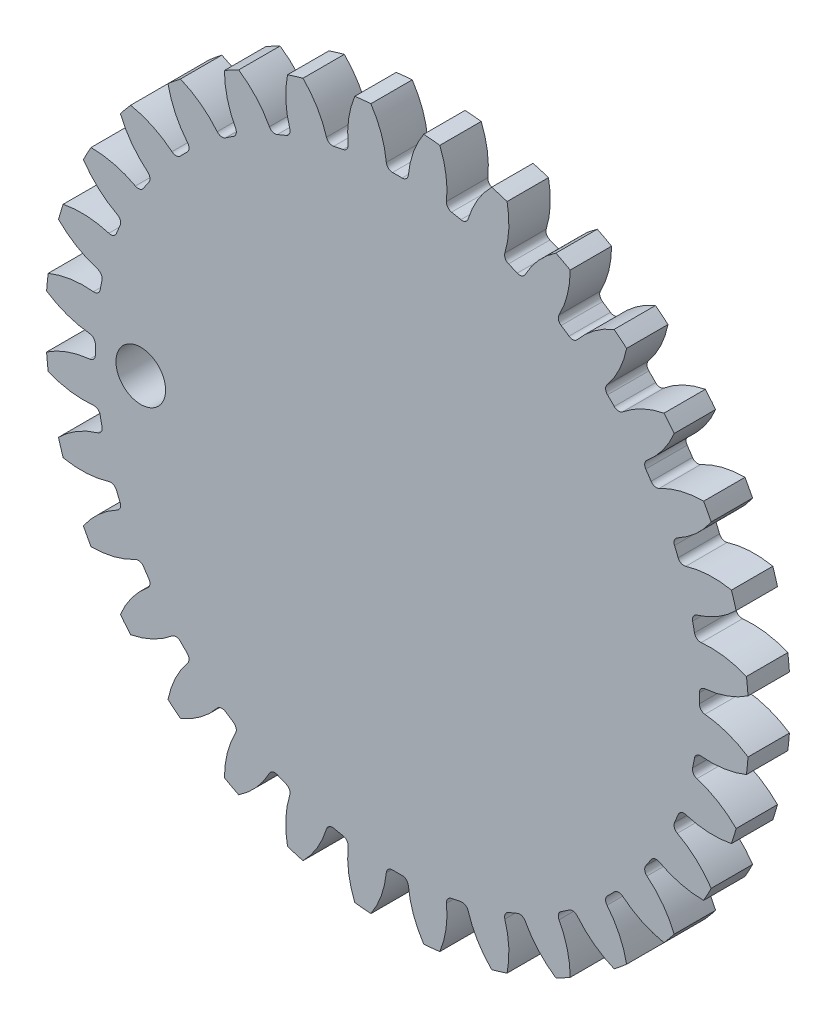
from build123d import *

# Parameters (mm, degrees)
SKETCH1_R                = 53.975
BOSS_EXTRUDE1_DEPTH      = 6.35
CUT_EXTRUDE1_DEPTH       = 6.35
FILLET1_R                = 0.9525
CIRPATTERN1_COUNT        = 32
FILLET1_OF_CIRPATTERN1_R = 0.9525
SKETCH4_R                = 12.065
BOSS_EXTRUDE2_DEPTH      = 6.35
SKETCH7_R                = 3.81
CUT_EXTRUDE2_DEPTH       = 77.380639867


with BuildPart() as part:
    # Sketch1 → Boss-Extrude1 (new body)
    with BuildSketch(Plane.XY):
        Circle(SKETCH1_R)
    extrude(amount=BOSS_EXTRUDE1_DEPTH)

    # Sketch2 → Cut-Extrude1 (cut)
    with BuildSketch(Plane.XY.offset(6.35)):
        with BuildLine():
            ThreePointArc((-1.634103754, 46.326188381), (-2.514224632, 50.797718303), (-4.74898903, 54.76949633))
            ThreePointArc((-4.74898903, 54.76949633), (0, 54.975), (4.74898903, 54.76949633))
            ThreePointArc((4.74898903, 54.76949633), (2.514224632, 50.797718303), (1.634103754, 46.326188381))
            ThreePointArc((1.634103754, 46.326188381), (0, 46.355), (-1.634103754, 46.326188381))
        make_face()
    cut_extrude1 = extrude(amount=-CUT_EXTRUDE1_DEPTH, mode=Mode.SUBTRACT)

    # Fillet1
    fillet1_edges = [part.edges().sort_by_distance(p)[0] for p in [
        (-1.634103754, 46.326188381, 3.175),
        (1.634103754, 46.326188381, 3.175),
    ]]
    fillet(fillet1_edges, radius=FILLET1_R)

    # CirPattern1: Cut-Extrude1 ×32 about axis
    cirpattern1_axis = Axis((0, 0, 0), (0, 0, 1))
    for i in range(1, CIRPATTERN1_COUNT):
        add(cut_extrude1.rotate(cirpattern1_axis, i * 360 / CIRPATTERN1_COUNT), mode=Mode.SUBTRACT)

    # Fillet1 of CirPattern1
    fillet1_of_cirpattern1_edges = [part.edges().sort_by_distance(p)[0] for p in [
        (-10.640495917, 45.117245834, 3.175),
        (-7.435086101, 45.754841489, 3.175),
        (-19.23797979, 42.174472831, 3.175),
        (-16.218549766, 43.425161698, 3.175),
        (-27.096158888, 37.61095849, 3.175),
        (-24.378743659, 39.426677296, 3.175),
        (-33.913047796, 31.602076105, 3.175),
        (-31.602076105, 33.913047796, 3.175),
        (-39.426677296, 24.378743659, 3.175),
        (-37.61095849, 27.096158888, 3.175),
        (-43.425161698, 16.218549766, 3.175),
        (-42.174472831, 19.23797979, 3.175),
        (-45.754841489, 7.435086101, 3.175),
        (-45.117245834, 10.640495917, 3.175),
        (-46.326188381, -1.634103754, 3.175),
        (-46.326188381, 1.634103754, 3.175),
        (-45.117245834, -10.640495917, 3.175),
        (-45.754841489, -7.435086101, 3.175),
        (-42.174472831, -19.23797979, 3.175),
        (-43.425161698, -16.218549766, 3.175),
        (-37.61095849, -27.096158888, 3.175),
        (-39.426677296, -24.378743659, 3.175),
        (-31.602076105, -33.913047796, 3.175),
        (-33.913047796, -31.602076105, 3.175),
        (-24.378743659, -39.426677296, 3.175),
        (-27.096158888, -37.61095849, 3.175),
        (-16.218549766, -43.425161698, 3.175),
        (-19.23797979, -42.174472831, 3.175),
        (-7.435086101, -45.754841489, 3.175),
        (-10.640495917, -45.117245834, 3.175),
        (1.634103754, -46.326188381, 3.175),
        (-1.634103754, -46.326188381, 3.175),
        (10.640495917, -45.117245834, 3.175),
        (7.435086101, -45.754841489, 3.175),
        (19.23797979, -42.174472831, 3.175),
        (16.218549766, -43.425161698, 3.175),
        (27.096158888, -37.61095849, 3.175),
        (24.378743659, -39.426677296, 3.175),
        (33.913047796, -31.602076105, 3.175),
        (31.602076105, -33.913047796, 3.175),
        (39.426677296, -24.378743659, 3.175),
        (37.61095849, -27.096158888, 3.175),
        (43.425161698, -16.218549766, 3.175),
        (42.174472831, -19.23797979, 3.175),
        (45.754841489, -7.435086101, 3.175),
        (45.117245834, -10.640495917, 3.175),
        (46.326188381, 1.634103754, 3.175),
        (46.326188381, -1.634103754, 3.175),
        (45.117245834, 10.640495917, 3.175),
        (45.754841489, 7.435086101, 3.175),
        (42.174472831, 19.23797979, 3.175),
        (43.425161698, 16.218549766, 3.175),
        (37.61095849, 27.096158888, 3.175),
        (39.426677296, 24.378743659, 3.175),
        (31.602076105, 33.913047796, 3.175),
        (33.913047796, 31.602076105, 3.175),
        (24.378743659, 39.426677296, 3.175),
        (27.096158888, 37.61095849, 3.175),
        (16.218549766, 43.425161698, 3.175),
        (19.23797979, 42.174472831, 3.175),
        (7.435086101, 45.754841489, 3.175),
        (10.640495917, 45.117245834, 3.175),
    ]]
    fillet(fillet1_of_cirpattern1_edges, radius=FILLET1_OF_CIRPATTERN1_R)

    # Sketch4 → Boss-Extrude2 (add)
    with BuildSketch(Plane(origin=(0, 0, 0), x_dir=(-1, 0, 0), z_dir=(0, 0, -1))):
        with Locations(Location((0, 0, 0), (0, 0, 180))):
            Circle(SKETCH4_R)
    extrude(amount=BOSS_EXTRUDE2_DEPTH)

    # Sketch7 → Cut-Extrude2 (cut, through all)
    with BuildSketch(Plane(origin=(0, 0, 0), x_dir=(-1, 0, 0), z_dir=(0, 0, -1))):
        with Locations((39.37, 0)):
            Circle(SKETCH7_R)
    extrude(amount=-CUT_EXTRUDE2_DEPTH, mode=Mode.SUBTRACT)


solid = part.part
